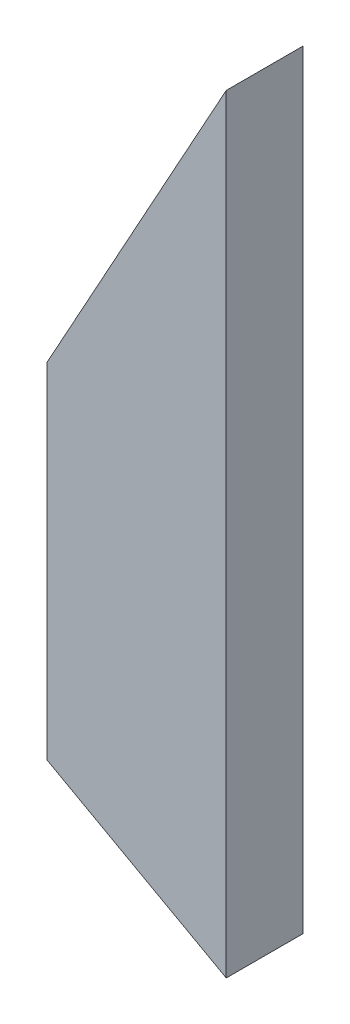
from build123d import *

# Parameters (mm, degrees)
BOSS_EXTRUDE1_DEPTH = 38.1


with BuildPart() as part:
    # Sketch1 → Boss-Extrude1 (new body)
    with BuildSketch(Plane.XY):
        Polygon((44.45, -190.5), (44.45, 190.5), (-44.45, 29.23000124), (-44.45, -141.313111503), align=None)
    extrude(amount=BOSS_EXTRUDE1_DEPTH)


solid = part.part
